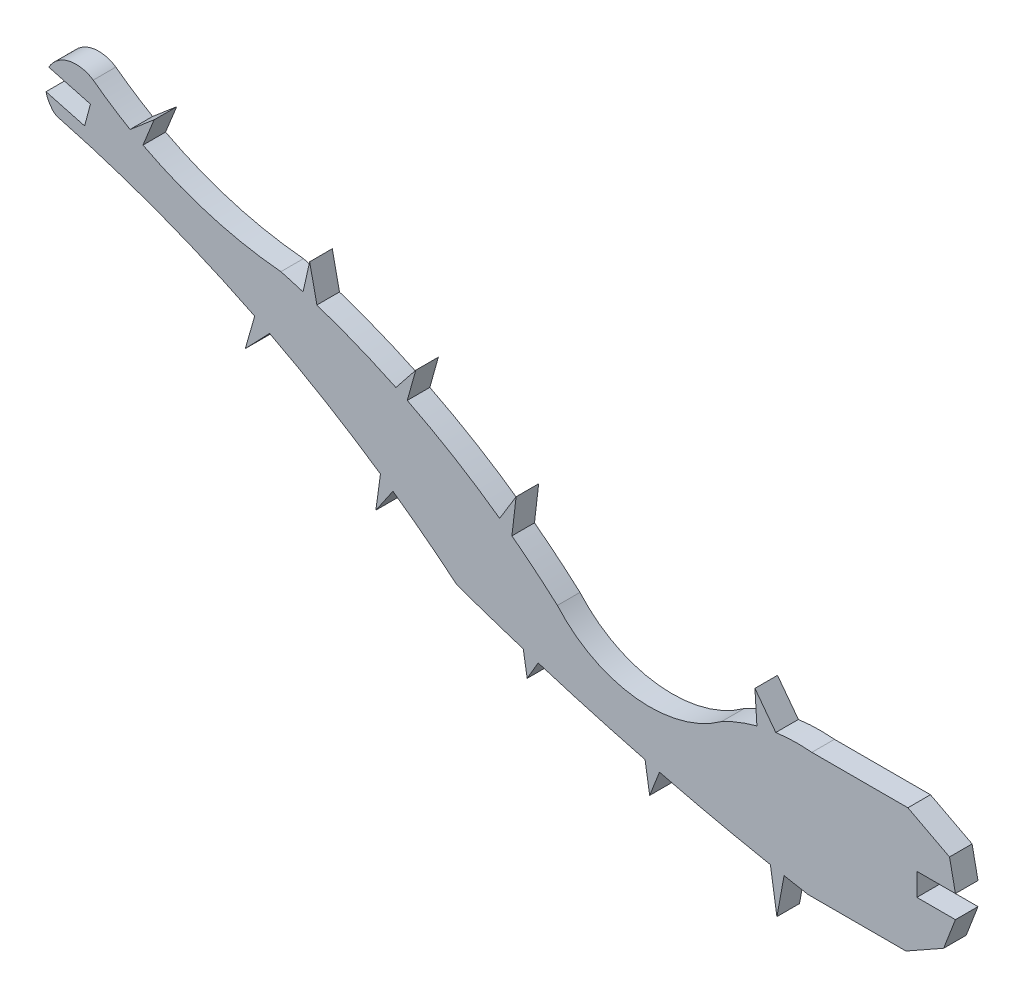
from build123d import *

# Parameters (mm, degrees)
BOSS_EXTRUDE1_DEPTH = 1.524
CUT_EXTRUDE1_DEPTH  = 1.524


with BuildPart() as part:
    # Sketch1 → Boss-Extrude1 (new body)
    with BuildSketch(Plane.XY):
        with BuildLine():
            Line((-65.62844389, -1.524), (-63.025670989, -1.524))
            Line((-63.025670989, -1.524), (-63.822514801, -3.597982164))
            Line((-63.822514801, -3.597982164), (-66.364740688, -5.02874479))
            Line((-66.364740688, -5.02874479), (-72.970412181, -5.02874479))
            ThreePointArc((-72.970412181, -5.02874479), (-73.780479042, -4.88253576), (-74.589728748, -4.731869528))
            Line((-74.589728748, -4.731869528), (-75.073084302, -7.372952412))
            Line((-75.073084302, -7.372952412), (-75.51502387, -4.553940069))
            ThreePointArc((-75.51502387, -4.553940069), (-79.267617574, -3.769993691), (-82.998880802, -2.890103837))
            Line((-82.998880802, -2.890103837), (-83.662208167, -4.580640418))
            Line((-83.662208167, -4.580640418), (-83.9742265, -2.643374593))
            ThreePointArc((-83.9742265, -2.643374593), (-87.594512539, -1.666053196), (-91.189152721, -0.598256357))
            Line((-91.189152721, -0.598256357), (-91.929187087, -1.873078309))
            Line((-91.929187087, -1.873078309), (-92.192549363, -0.282576404))
            ThreePointArc((-92.192549363, -0.282576404), (-94.43829357, 0.452244536), (-96.672145794, 1.2224608))
            ThreePointArc((-96.672145794, 1.2224608), (-98.79856677, 2.920982901), (-100.989304929, 4.535699537))
            Line((-100.989304929, 4.535699537), (-102.141504416, 2.851715672))
            Line((-102.141504416, 2.851715672), (-101.830844258, 5.121924515))
            ThreePointArc((-101.830844258, 5.121924515), (-105.503835902, 7.476274523), (-109.316148256, 9.597619873))
            Line((-109.316148256, 9.597619873), (-110.95226101, 7.891468444))
            Line((-110.95226101, 7.891468444), (-110.319639872, 10.105642428))
            ThreePointArc((-110.319639872, 10.105642428), (-116.815196671, 12.929470472), (-123.562513889, 15.083530197))
            ThreePointArc((-123.562513889, 15.083530197), (-123.779823463, 15.177511529), (-123.959746364, 15.331406595))
            ThreePointArc((-123.959746364, 15.331406595), (-123.949496649, 18.088692586), (-121.216404531, 18.453300008))
            ThreePointArc((-121.216404531, 18.453300008), (-119.99831308, 17.594979685), (-118.73086738, 16.811371391))
            Line((-118.73086738, 16.811371391), (-117.11063531, 18.184449417))
            Line((-117.11063531, 18.184449417), (-117.859531811, 16.331247904))
            ThreePointArc((-117.859531811, 16.331247904), (-113.341616748, 14.499894981), (-108.552725398, 13.587793188))
            ThreePointArc((-108.552725398, 13.587793188), (-107.803028846, 13.376700844), (-107.057015293, 13.152940531))
            Line((-107.057015293, 13.152940531), (-106.609325514, 15.13772615))
            Line((-106.609325514, 15.13772615), (-106.122626057, 12.853069881))
            ThreePointArc((-106.122626057, 12.853069881), (-103.421109493, 11.859213859), (-100.787074077, 10.698266414))
            Line((-100.787074077, 10.698266414), (-99.448684771, 12.381094003))
            Line((-99.448684771, 12.381094003), (-100.023702083, 10.324148845))
            ThreePointArc((-100.023702083, 10.324148845), (-96.831167643, 8.560951785), (-93.788416789, 6.550278449))
            Line((-93.788416789, 6.550278449), (-92.677002467, 8.368956431))
            Line((-92.677002467, 8.368956431), (-92.959454339, 5.939754488))
            ThreePointArc((-92.959454339, 5.939754488), (-91.397772197, 4.708540381), (-89.890787426, 3.410951775))
            ThreePointArc((-89.890787426, 3.410951775), (-84.591869737, 0.643036614), (-78.809267625, 2.160071819))
            ThreePointArc((-78.809267625, 2.160071819), (-77.644578081, 2.700645179), (-76.424081928, 3.09953167))
            Line((-76.424081928, 3.09953167), (-76.558408494, 5.228958142))
            Line((-76.558408494, 5.228958142), (-75.149258413, 3.353285973))
            ThreePointArc((-75.149258413, 3.353285973), (-73.933139466, 3.450839152), (-72.713766302, 3.410951775))
            Line((-72.713766302, 3.410951775), (-66.233949818, 3.410951775))
            Line((-66.233949818, 3.410951775), (-63.424092895, 1.94149826))
            Line((-63.424092895, 1.94149826), (-63.025670989, 0))
            Line((-63.025670989, 0), (-65.62844389, 0))
            Line((-65.62844389, 0), (-65.62844389, -1.524))
        make_face()
    extrude(amount=BOSS_EXTRUDE1_DEPTH)

    # Sketch2 → Cut-Extrude1 (cut)
    with BuildSketch(Plane.XY.offset(1.524)):
        Polygon((-126.267748699, 16.679917712), (-121.799652461, 15.482694933), (-121.405212236, 16.954765892), (-125.873308475, 18.151988671), align=None)
    extrude(amount=-CUT_EXTRUDE1_DEPTH, mode=Mode.SUBTRACT)


solid = part.part
